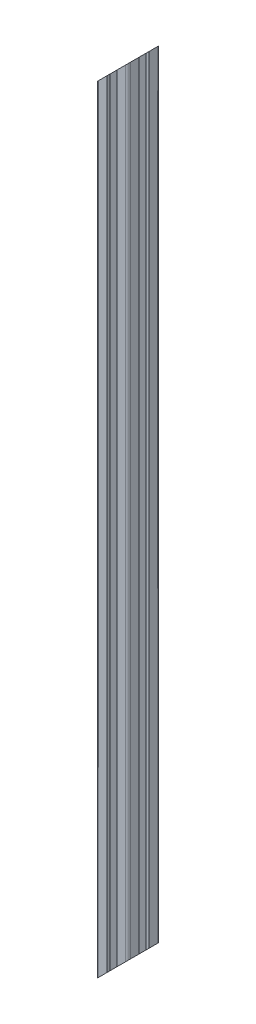
from build123d import *

# Parameters (mm, degrees)
SKETCH_1_R          = 2.5
EXTRUDE_1_DEPTH     = 506.79
CUT_EXTRUDE_1_DEPTH = 508.341254196


with BuildPart() as part:
    # 草图1 → 凸台-拉伸1 (new body)
    with BuildSketch(Plane(origin=(0, 0, 0), x_dir=(1, 0, 0), z_dir=(0, 1, 0))):
        with BuildLine():
            Line((-10.811269129, -4.789644731), (-12.611269129, -4.789644731))
            Line((-12.611269129, -4.789644731), (-12.611269129, -10.189644731))
            ThreePointArc((-12.611269129, -10.189644731), (-12.171929301, -11.250304902), (-11.111269129, -11.689644731))
            Line((-11.111269129, -11.689644731), (-5.711269129, -11.689644731))
            Line((-5.711269129, -11.689644731), (-5.711269129, -9.889644731))
            Line((-5.711269129, -9.889644731), (-8.111269129, -9.889644731))
            Line((-8.111269129, -9.889644731), (-8.111269129, -8.086694886))
            Line((-8.111269129, -8.086694886), (-4.814218974, -4.789644731))
            Line((-4.814218974, -4.789644731), (-0.408319284, -4.789644731))
            Line((-0.408319284, -4.789644731), (2.888730871, -8.086694886))
            Line((2.888730871, -8.086694886), (2.888730871, -9.889644731))
            Line((2.888730871, -9.889644731), (0.488730871, -9.889644731))
            Line((0.488730871, -9.889644731), (0.488730871, -11.689644731))
            Line((0.488730871, -11.689644731), (5.888730871, -11.689644731))
            ThreePointArc((5.888730871, -11.689644731), (6.949391043, -11.250304902), (7.388730871, -10.189644731))
            Line((7.388730871, -10.189644731), (7.388730871, -4.789644731))
            Line((7.388730871, -4.789644731), (5.588730871, -4.789644731))
            Line((5.588730871, -4.789644731), (5.588730871, -7.189644731))
            Line((5.588730871, -7.189644731), (3.785781026, -7.189644731))
            Line((3.785781026, -7.189644731), (0.442857891, -3.846721596))
            Line((0.442857891, -3.846721596), (0.442857891, 0.467432135))
            Line((0.442857891, 0.467432135), (3.785781026, 3.810355269))
            Line((3.785781026, 3.810355269), (5.588730871, 3.810355269))
            Line((5.588730871, 3.810355269), (5.588730871, 1.410355269))
            Line((5.588730871, 1.410355269), (7.388730871, 1.410355269))
            Line((7.388730871, 1.410355269), (7.388730871, 6.810355269))
            ThreePointArc((7.388730871, 6.810355269), (6.949391043, 7.871015441), (5.888730871, 8.310355269))
            Line((5.888730871, 8.310355269), (0.488730871, 8.310355269))
            Line((0.488730871, 8.310355269), (0.488730871, 6.510355269))
            Line((0.488730871, 6.510355269), (2.888730871, 6.510355269))
            Line((2.888730871, 6.510355269), (2.888730871, 4.707405425))
            Line((2.888730871, 4.707405425), (-0.408319284, 1.410355269))
            Line((-0.408319284, 1.410355269), (-4.814218974, 1.410355269))
            Line((-4.814218974, 1.410355269), (-8.111269129, 4.707405425))
            Line((-8.111269129, 4.707405425), (-8.111269129, 6.510355269))
            Line((-8.111269129, 6.510355269), (-5.711269129, 6.510355269))
            Line((-5.711269129, 6.510355269), (-5.711269129, 8.310355269))
            Line((-5.711269129, 8.310355269), (-11.111269129, 8.310355269))
            ThreePointArc((-11.111269129, 8.310355269), (-12.171929301, 7.871015441), (-12.611269129, 6.810355269))
            Line((-12.611269129, 6.810355269), (-12.611269129, 1.410355269))
            Line((-12.611269129, 1.410355269), (-10.811269129, 1.410355269))
            Line((-10.811269129, 1.410355269), (-10.811269129, 3.810355269))
            Line((-10.811269129, 3.810355269), (-9.008319284, 3.810355269))
            Line((-9.008319284, 3.810355269), (-5.665396149, 0.467432135))
            Line((-5.665396149, 0.467432135), (-5.665396149, -3.846721596))
            Line((-5.665396149, -3.846721596), (-9.008319284, -7.189644731))
            Line((-9.008319284, -7.189644731), (-10.811269129, -7.189644731))
            Line((-10.811269129, -7.189644731), (-10.811269129, -4.789644731))
        make_face()
        with Locations(Location((-2.611269129, -1.689644731, 0), (0, 0, 270))):
            Circle(SKETCH_1_R, mode=Mode.SUBTRACT)
    extrude(amount=EXTRUDE_1_DEPTH)

    # 草图2 → 切除-拉伸1 (cut, through all)
    with BuildSketch(Plane(origin=(0, 0, -8.310355269), x_dir=(-1, 0, 0), z_dir=(0, 0, -1))):
        Polygon((-7.388730871, 506.79), (12.611269129, 486.79), (12.611269129, 506.79), align=None)
        Polygon((12.611269129, 0), (-7.388730871, 20), (-7.388730871, 0), align=None)
    extrude(amount=-CUT_EXTRUDE_1_DEPTH, mode=Mode.SUBTRACT)


solid = part.part
